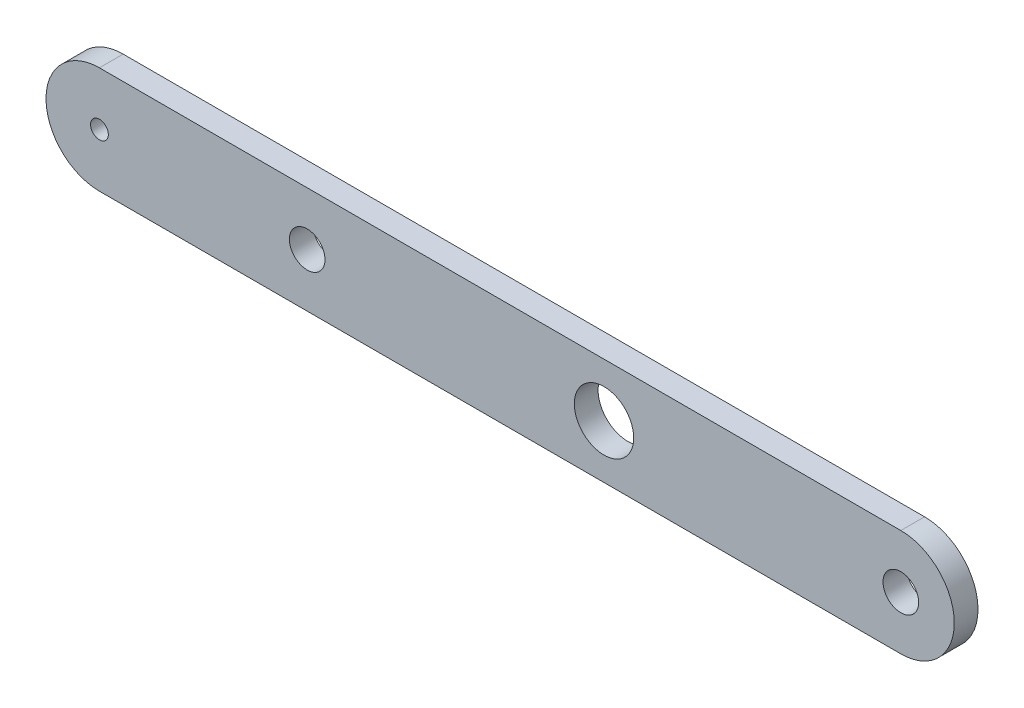
from build123d import *

# Parameters (mm, degrees)
SKETCH_1_R      = 3
SKETCH_1_R_2    = 1.5
SKETCH_1_R_3    = 5
EXTRUDE_1_DEPTH = 4


with BuildPart() as part:
    # ｽｹｯﾁ1 → ﾎﾞｽ - 押し出し1 (new body)
    with BuildSketch(Plane.XY):
        with BuildLine():
            Line((-35, 9), (100, 9))
            ThreePointArc((100, 9), (109, 0), (100, -9))
            Line((100, -9), (-35, -9))
            ThreePointArc((-35, -9), (-44, 0), (-35, 9))
        make_face()
        with Locations((100, 0)):
            Circle(SKETCH_1_R, mode=Mode.SUBTRACT)
        Circle(SKETCH_1_R, mode=Mode.SUBTRACT)
        with Locations((-35, 0)):
            Circle(SKETCH_1_R_2, mode=Mode.SUBTRACT)
        with Locations((50, 0)):
            Circle(SKETCH_1_R_3, mode=Mode.SUBTRACT)
    extrude(amount=EXTRUDE_1_DEPTH)


solid = part.part
